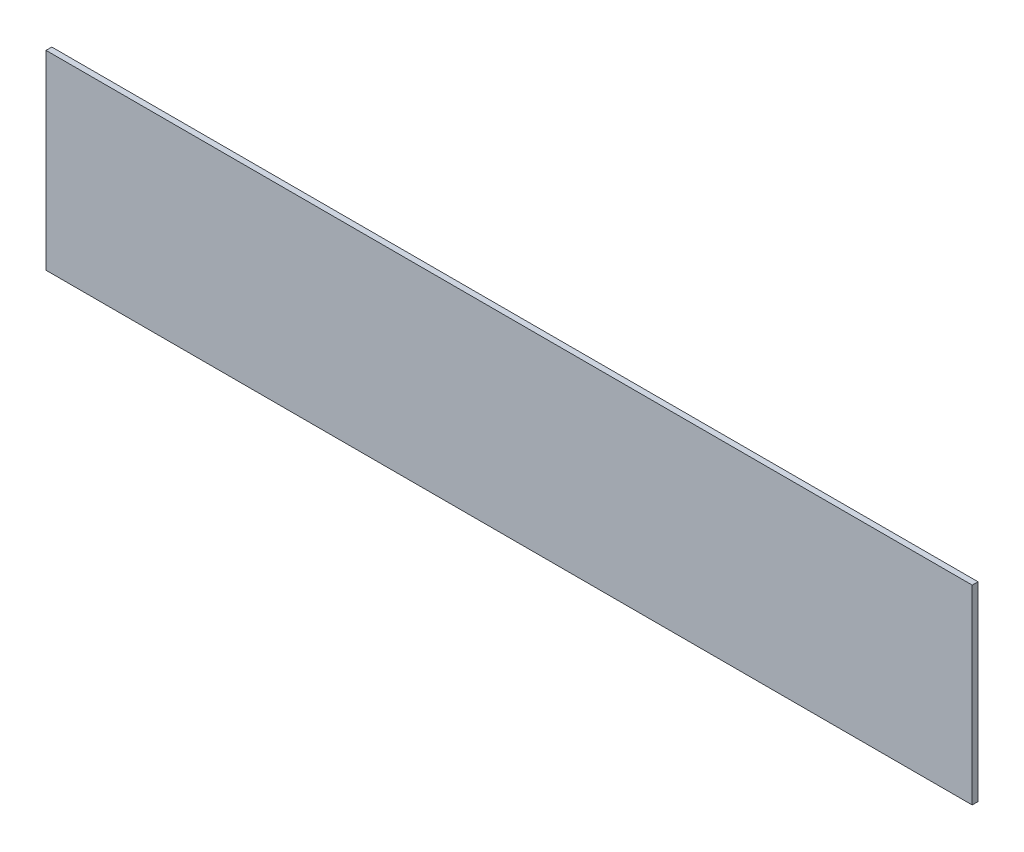
from build123d import *

# Parameters (mm, degrees)
SKETCH1_W           = 203.2
SKETCH1_H           = 41.783
BOSS_EXTRUDE1_DEPTH = 1.27


with BuildPart() as part:
    # Sketch1 → Boss-Extrude1 (new body)
    with BuildSketch(Plane.XY):
        with Locations((54.987415375, -5.72794171)):
            Rectangle(SKETCH1_W, SKETCH1_H)
    extrude(amount=BOSS_EXTRUDE1_DEPTH)


solid = part.part
